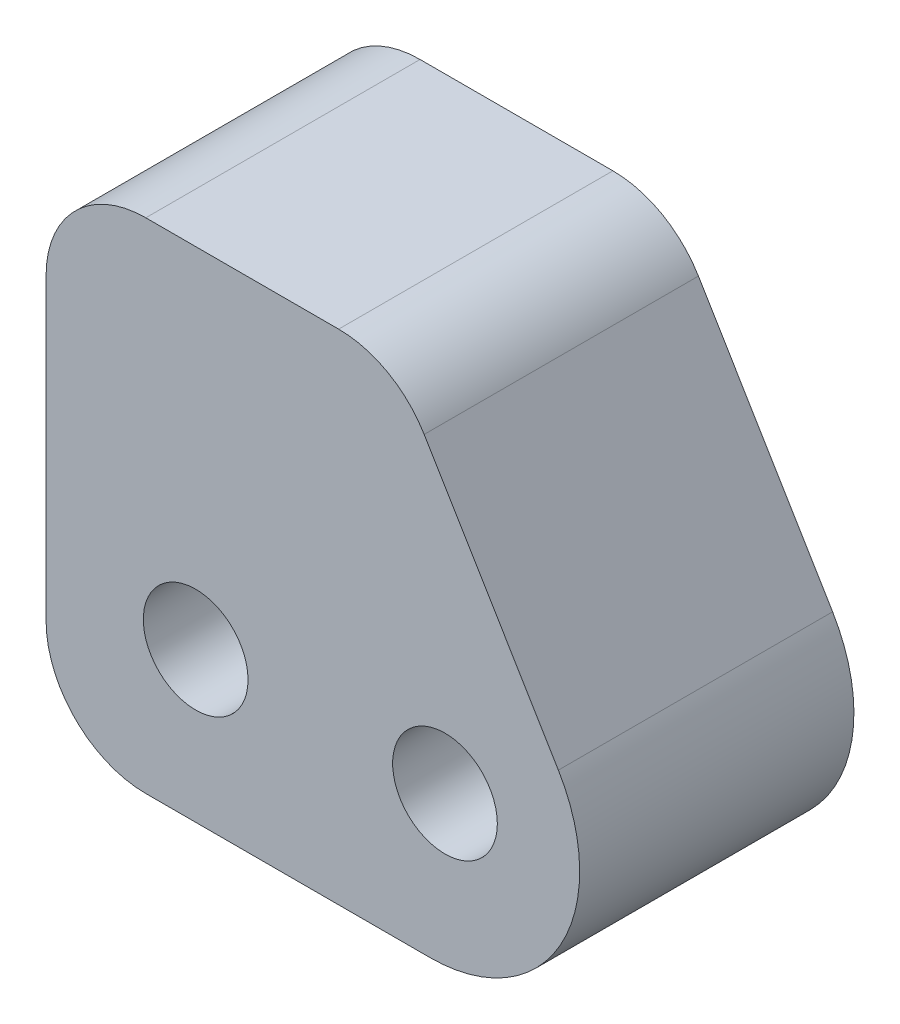
from build123d import *

# Parameters (mm, degrees)
SKETCH_1_R      = 1.05
EXTRUDE_1_DEPTH = 5.5
FILLET_1_R      = 3
FILLET_2_R      = 2


with BuildPart() as part:
    # ｽｹｯﾁ1 → ﾎﾞｽ - 押し出し1 (new body)
    with BuildSketch(Plane.XY):
        Polygon((0, 0), (13, 0), (7, 10), (0, 10), align=None)
        with Locations((3, 3)):
            Circle(SKETCH_1_R, mode=Mode.SUBTRACT)
        with Locations((8, 3)):
            Circle(SKETCH_1_R, mode=Mode.SUBTRACT)
    extrude(amount=EXTRUDE_1_DEPTH)

    # ﾌｨﾚｯﾄ1
    fillet_1_edges = [part.edges().sort_by_distance(p)[0] for p in [
        (13, 0, 2.75),
    ]]
    fillet(fillet_1_edges, radius=FILLET_1_R)

    # ﾌｨﾚｯﾄ2
    fillet_2_edges = [part.edges().sort_by_distance(p)[0] for p in [
        (0, 10, 2.75),
        (7, 10, 2.75),
        (0, 0, 2.75),
    ]]
    fillet(fillet_2_edges, radius=FILLET_2_R)


solid = part.part
